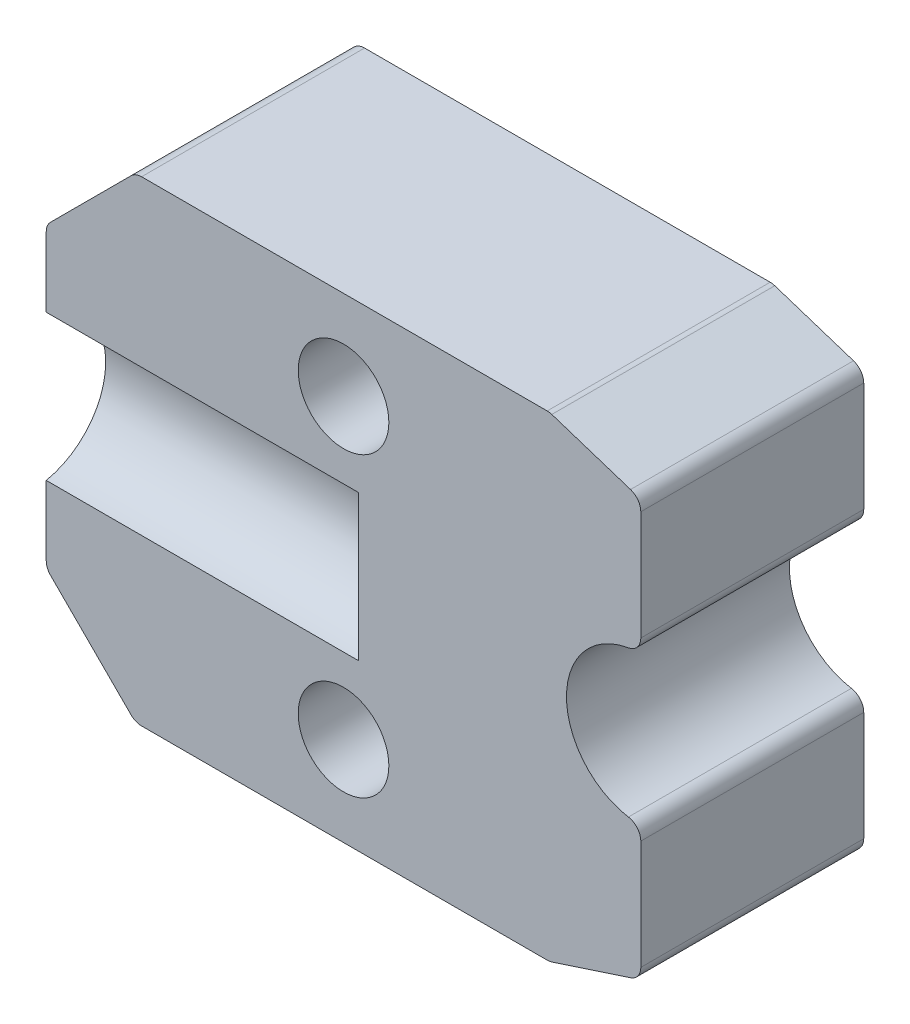
from build123d import *

# Parameters (mm, degrees)
SKETCH_1_R          = 1.525
EXTRUDE_1_DEPTH     = 3.75
SKETCH_2_R          = 2.5
CUT_EXTRUDE_1_DEPTH = 10.5
CHAMFER_1_SIZE      = 3
SKETCH_3_R          = 2.5
CUT_EXTRUDE_2_DEPTH = 15.84082208
FILLET_1_R          = 0.5


with BuildPart() as part:
    # 草图1 → 凸台-拉伸1 (new, symmetric)
    with BuildSketch(Plane.XY):
        Polygon((-10, 8), (-10, -8), (6.931382282, -8), (10, -7), (10, 7), (6.931382282, 8), align=None)
        with Locations((0, 5)):
            Circle(SKETCH_1_R, mode=Mode.SUBTRACT)
        with Locations((0, -5)):
            Circle(SKETCH_1_R, mode=Mode.SUBTRACT)
    extrude(amount=EXTRUDE_1_DEPTH, both=True)

    # 草图2 → 切除-拉伸1 (cut)
    with BuildSketch(Plane.ZY.offset(10)):
        with Locations((4.25, 0)):
            Circle(SKETCH_2_R)
    extrude(amount=-CUT_EXTRUDE_1_DEPTH, mode=Mode.SUBTRACT)

    # 倒角1
    chamfer_1_edges = [part.edges().sort_by_distance(p)[0] for p in [
        (-10, -8, 0),
        (-10, 8, 0),
    ]]
    chamfer(chamfer_1_edges, length=CHAMFER_1_SIZE)

    # 草图3 → 切除-拉伸2 (cut, through all)
    with BuildSketch(Plane(origin=(0, 0, -3.75), x_dir=(-1, 0, 0), z_dir=(0, 0, -1))):
        with Locations((-10, 0)):
            Circle(SKETCH_3_R)
    extrude(amount=-CUT_EXTRUDE_2_DEPTH, mode=Mode.SUBTRACT)

    # 圆角1
    fillet_1_edges = [part.edges().sort_by_distance(p)[0] for p in [
        (6.931382282, 8, 0),
        (10, 7, 0),
        (10, -7, 0),
        (6.931382282, -8, 0),
        (-7, -8, 0),
        (-10, 5, 0),
        (-10, -5, 0),
        (-7, 8, 0),
        (10, -2.5, 0),
        (10, 2.5, 0),
    ]]
    fillet(fillet_1_edges, radius=FILLET_1_R)


solid = part.part
